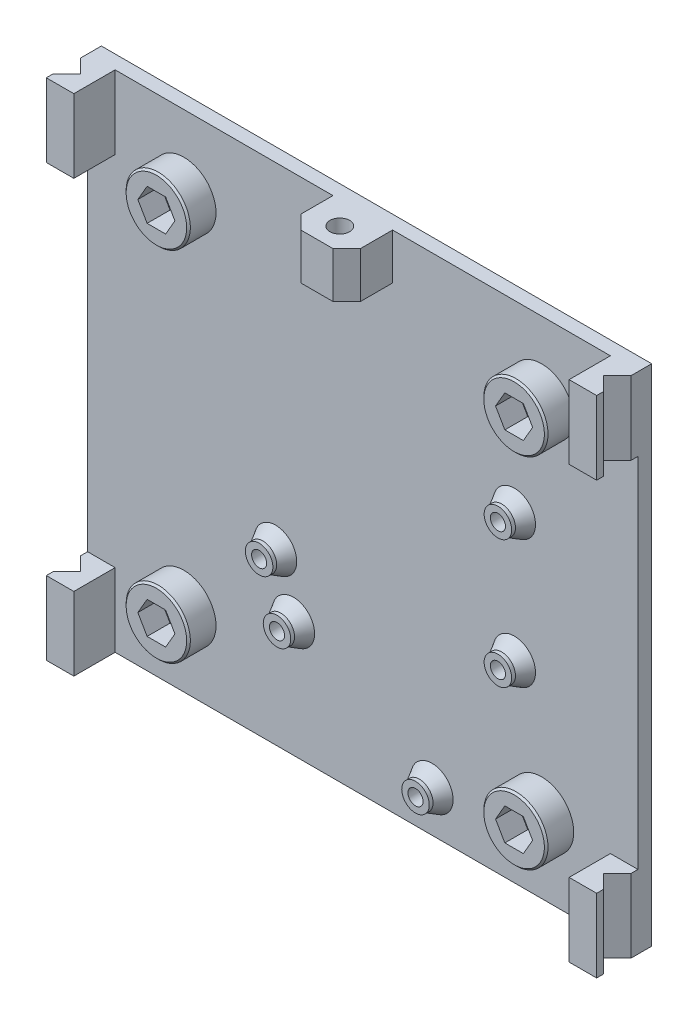
from build123d import *

# Parameters (mm, degrees)
SKETCH1_W               = 120
SKETCH1_H               = 110
SKETCH1_R               = 2.15
SKETCH1_R_2             = 1.65
BOSS_EXTRUDE1_DEPTH     = 3
SKETCH2_R               = 3
SKETCH2_R_2             = 1.65
BOSS_EXTRUDE2_DEPTH     = 6.6
CHAMFER5_SIZE           = 1.6
CHAMFER5_SIZE2          = 2.771281292
CUT_EXTRUDE1_DEPTH      = 4
SKETCH4_R               = 7
SKETCH4_R_2             = 2.15
BOSS_EXTRUDE3_DEPTH     = 9
CUT_EXTRUDE2_DEPTH      = 5
CHAMFER2_SIZE           = 0.4
SKETCH6_W               = 9
SKETCH6_H               = 16
BOSS_EXTRUDE4_DEPTH     = 6
CUT_EXTRUDE3_DEPTH      = 126.87295182
CUT_EXTRUDE3_DEPTH_BACK = 126.87295182
SKETCH8_W               = 13
SKETCH8_H               = 10
SKETCH8_R               = 2.15
BOSS_EXTRUDE5_DEPTH     = 10
CUT_EXTRUDE5_DEPTH      = 5
CHAMFER9_SIZE           = 3


with BuildPart() as part:
    # Sketch1 → Boss-Extrude1 (new body)
    with BuildSketch(Plane.XY):
        Rectangle(SKETCH1_W, SKETCH1_H)
        with Locations((-39, 39)):
            Circle(SKETCH1_R, mode=Mode.SUBTRACT)
        with Locations((39, 39)):
            Circle(SKETCH1_R, mode=Mode.SUBTRACT)
        with Locations((39, -39)):
            Circle(SKETCH1_R, mode=Mode.SUBTRACT)
        with Locations((-39, -39)):
            Circle(SKETCH1_R, mode=Mode.SUBTRACT)
        with Locations((33.07, 14.94)):
            Circle(SKETCH1_R_2, mode=Mode.SUBTRACT)
        with Locations((33.07, -13)):
            Circle(SKETCH1_R_2, mode=Mode.SUBTRACT)
        with Locations((-19, -18.08)):
            Circle(SKETCH1_R_2, mode=Mode.SUBTRACT)
        with Locations((-15.1, -29.75)):
            Circle(SKETCH1_R_2, mode=Mode.SUBTRACT)
        with Locations((15.1, -46)):
            Circle(SKETCH1_R_2, mode=Mode.SUBTRACT)
    extrude(amount=BOSS_EXTRUDE1_DEPTH)

    # Sketch2 → Boss-Extrude2 (add)
    # profile 1 of 5: a face of its own
    with BuildSketch(Plane(origin=(0, 0, 0), x_dir=(-1, 0, 0), z_dir=(0, 0, -1))):
        with Locations((-33.07, -13)):
            Circle(SKETCH2_R)
        with Locations((-33.07, -13)):
            Circle(SKETCH2_R_2, mode=Mode.SUBTRACT)
    # profile 2 of 5: a face of its own
    with BuildSketch(Plane(origin=(0, 0, 0), x_dir=(-1, 0, 0), z_dir=(0, 0, -1))):
        with Locations((19, -18.08)):
            Circle(SKETCH2_R)
        with Locations((19, -18.08)):
            Circle(SKETCH2_R_2, mode=Mode.SUBTRACT)
    # profile 3 of 5: a face of its own
    with BuildSketch(Plane(origin=(0, 0, 0), x_dir=(-1, 0, 0), z_dir=(0, 0, -1))):
        with Locations((-33.07, 14.94)):
            Circle(SKETCH2_R)
        with Locations((-33.07, 14.94)):
            Circle(SKETCH2_R_2, mode=Mode.SUBTRACT)
    # profile 4 of 5: a face of its own
    with BuildSketch(Plane(origin=(0, 0, 0), x_dir=(-1, 0, 0), z_dir=(0, 0, -1))):
        with Locations((-15.1, -46)):
            Circle(SKETCH2_R)
        with Locations((-15.1, -46)):
            Circle(SKETCH2_R_2, mode=Mode.SUBTRACT)
    # profile 5 of 5: a face of its own
    with BuildSketch(Plane(origin=(0, 0, 0), x_dir=(-1, 0, 0), z_dir=(0, 0, -1))):
        with Locations((15.1, -29.75)):
            Circle(SKETCH2_R)
        with Locations((15.1, -29.75)):
            Circle(SKETCH2_R_2, mode=Mode.SUBTRACT)
    extrude(amount=-BOSS_EXTRUDE2_DEPTH)

    # Chamfer5
    chamfer5_edges = [part.edges().sort_by_distance(p)[0] for p in [
        (36.07, -13, 3),
        (-16, -18.08, 3),
        (36.07, 14.94, 3),
        (18.1, -46, 3),
        (-12.1, -29.75, 3),
    ]]
    chamfer5_side = [part.faces().sort_by_distance(p)[0] for p in [
        (-0.102522824, 0.199847736, 3),
    ]]
    chamfer(chamfer5_edges, length=CHAMFER5_SIZE, length2=CHAMFER5_SIZE2, reference=chamfer5_side[0])

    # Sketch3 → Cut-Extrude1 (cut)
    with BuildSketch(Plane(origin=(0, 0, 0), x_dir=(-1, 0, 0), z_dir=(0, 0, -1))):
        Polygon((-31.48228676, 12.19), (-29.894573519, 14.94), (-31.48228676, 17.69), (-34.65771324, 17.69), (-36.245426481, 14.94), (-34.65771324, 12.19), align=None)
        Polygon((-31.48228676, -15.75), (-29.894573519, -13), (-31.48228676, -10.25), (-34.65771324, -10.25), (-36.245426481, -13), (-34.65771324, -15.75), align=None)
        Polygon((20.58771324, -20.83), (22.175426481, -18.08), (20.58771324, -15.33), (17.41228676, -15.33), (15.824573519, -18.08), (17.41228676, -20.83), align=None)
        Polygon((16.68771324, -32.5), (18.275426481, -29.75), (16.68771324, -27), (13.51228676, -27), (11.924573519, -29.75), (13.51228676, -32.5), align=None)
        Polygon((-13.51228676, -48.75), (-11.924573519, -46), (-13.51228676, -43.25), (-16.68771324, -43.25), (-18.275426481, -46), (-16.68771324, -48.75), align=None)
    extrude(amount=-CUT_EXTRUDE1_DEPTH, mode=Mode.SUBTRACT)

    # Sketch4 → Boss-Extrude3 (add)
    # profile 1 of 4: a face of its own
    with BuildSketch(Plane(origin=(0, 0, 0), x_dir=(-1, 0, 0), z_dir=(0, 0, -1))):
        with Locations((-39, 39)):
            Circle(SKETCH4_R)
        with Locations((-39, 39)):
            Circle(SKETCH4_R_2, mode=Mode.SUBTRACT)
    # profile 2 of 4: a face of its own
    with BuildSketch(Plane(origin=(0, 0, 0), x_dir=(-1, 0, 0), z_dir=(0, 0, -1))):
        with Locations((39, 39)):
            Circle(SKETCH4_R)
        with Locations((39, 39)):
            Circle(SKETCH4_R_2, mode=Mode.SUBTRACT)
    # profile 3 of 4: a face of its own
    with BuildSketch(Plane(origin=(0, 0, 0), x_dir=(-1, 0, 0), z_dir=(0, 0, -1))):
        with Locations((39, -39)):
            Circle(SKETCH4_R)
        with Locations((39, -39)):
            Circle(SKETCH4_R_2, mode=Mode.SUBTRACT)
    # profile 4 of 4: a face of its own
    with BuildSketch(Plane(origin=(0, 0, 0), x_dir=(-1, 0, 0), z_dir=(0, 0, -1))):
        with Locations((-39, -39)):
            Circle(SKETCH4_R)
        with Locations((-39, -39)):
            Circle(SKETCH4_R_2, mode=Mode.SUBTRACT)
    extrude(amount=-BOSS_EXTRUDE3_DEPTH)

    # Sketch5 → Cut-Extrude2 (cut)
    with BuildSketch(Plane.XY.offset(9)):
        Polygon((-36.979274058, 42.5), (-41.020725942, 42.5), (-43.041451884, 39), (-41.020725942, 35.5), (-36.979274058, 35.5), (-34.958548116, 39), align=None)
        Polygon((36.979274058, 42.5), (34.958548116, 39), (36.979274058, 35.5), (41.020725942, 35.5), (43.041451884, 39), (41.020725942, 42.5), align=None)
        Polygon((36.979274058, -35.5), (34.958548116, -39), (36.979274058, -42.5), (41.020725942, -42.5), (43.041451884, -39), (41.020725942, -35.5), align=None)
        Polygon((-36.979274058, -35.5), (-41.020725942, -35.5), (-43.041451884, -39), (-41.020725942, -42.5), (-36.979274058, -42.5), (-34.958548116, -39), align=None)
    extrude(amount=-CUT_EXTRUDE2_DEPTH, mode=Mode.SUBTRACT)

    # Chamfer2
    chamfer2_edges = [part.edges().sort_by_distance(p)[0] for p in [
        (46, 39, 9),
        (-32, 39, 9),
        (-32, -39, 9),
        (46, -39, 9),
    ]]
    chamfer(chamfer2_edges, length=CHAMFER2_SIZE)

    # Sketch6 → Boss-Extrude4 (add)
    with BuildSketch(Plane.ZY.offset(60)):
        with Locations((7.5, 47)):
            Rectangle(SKETCH6_W, SKETCH6_H)
        with Locations((7.5, -47)):
            Rectangle(SKETCH6_W, SKETCH6_H)
    boss_extrude4 = extrude(amount=-BOSS_EXTRUDE4_DEPTH)

    # Mirror1: Boss-Extrude4 across plane
    add(boss_extrude4.mirror(Plane(origin=(0, 0, 0), x_dir=(0, 0, 1), z_dir=(1, 0, 0))))

    # Sketch7 → Cut-Extrude3 (cut, two sides: drawn at the far end of the back side and taken through both)
    with BuildSketch(Plane(origin=(0, 55, 0), x_dir=(1, 0, 0), z_dir=(0, 1, 0)).offset(-CUT_EXTRUDE3_DEPTH_BACK)):
        Polygon((-60, -10.5), (-57, -7.5), (-60, -4.5), align=None)
        Polygon((60, -10.5), (57, -7.5), (60, -4.5), align=None)
    extrude(amount=CUT_EXTRUDE3_DEPTH + CUT_EXTRUDE3_DEPTH_BACK, mode=Mode.SUBTRACT)

    # Sketch8 → Boss-Extrude5 (add)
    with BuildSketch(Plane(origin=(0, 55, 0), x_dir=(1, 0, 0), z_dir=(0, 1, 0))):
        with Locations((0, -8)):
            Rectangle(SKETCH8_W, SKETCH8_H)
        with Locations(Location((0, -8, 0), (0, 0, 180))):
            Circle(SKETCH8_R, mode=Mode.SUBTRACT)
    extrude(amount=-BOSS_EXTRUDE5_DEPTH)

    # Sketch9 → Cut-Extrude5 (cut)
    with BuildSketch(Plane.XZ.offset(-45)):
        Polygon((0, 12.041451884), (-3.5, 10.020725942), (-3.5, 5.979274058), (0, 3.958548116), (3.5, 5.979274058), (3.5, 10.020725942), align=None)
    extrude(amount=-CUT_EXTRUDE5_DEPTH, mode=Mode.SUBTRACT)

    # Chamfer9
    chamfer9_edges = [part.edges().sort_by_distance(p)[0] for p in [
        (-6.5, 50, 13),
        (6.5, 50, 13),
    ]]
    chamfer(chamfer9_edges, length=CHAMFER9_SIZE)


solid = part.part
